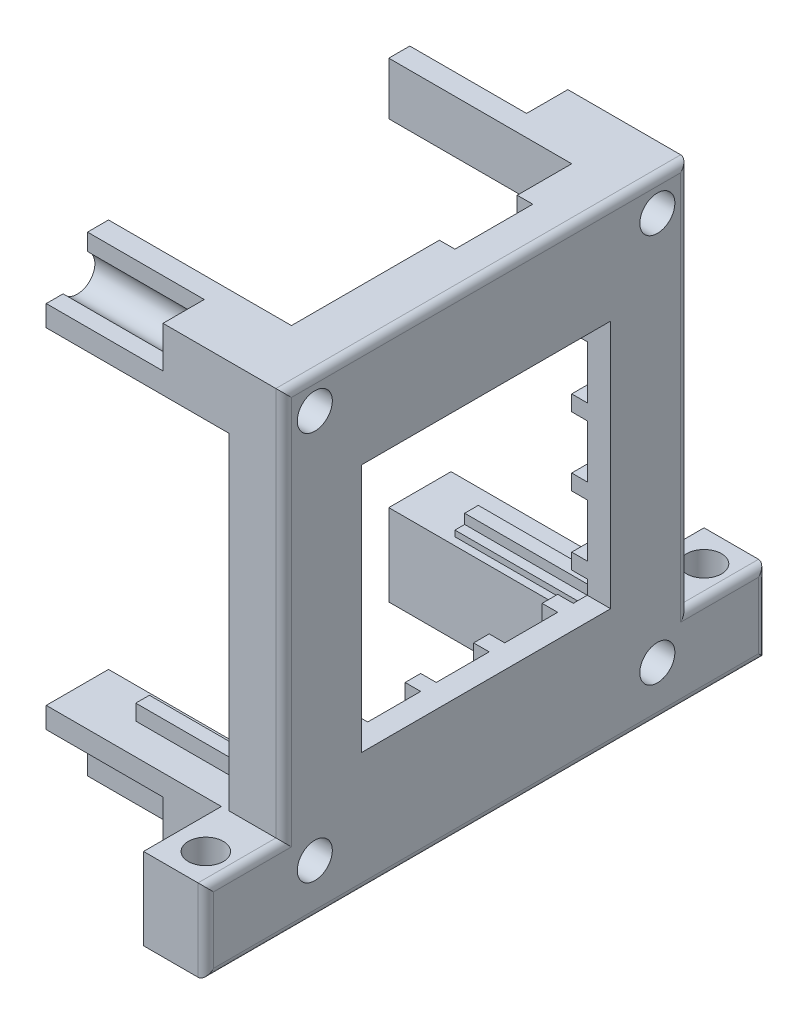
from build123d import *

# Parameters (mm, degrees)
SKETCH1_W               = 52
SKETCH1_H               = 58
SKETCH1_W_2             = 32
SKETCH1_H_2             = 32
BOSS_EXTRUDE1_DEPTH     = 3
SKETCH2_W               = 52
SKETCH2_H               = 58
SKETCH2_W_2             = 42
SKETCH2_H_2             = 42
BOSS_EXTRUDE2_DEPTH     = 4
SKETCH3_W               = 8
SKETCH3_H               = 8
BOSS_EXTRUDE3_DEPTH     = 23.5
SKETCH4_R               = 2.25
CUT_EXTRUDE1_DEPTH      = 50.469687689
SKETCH5_W               = 5.3
SKETCH5_H               = 5.3
CUT_EXTRUDE2_DEPTH      = 15
MIRROR2_COPY_1_SKETCH_W = 8
MIRROR2_COPY_1_SKETCH_H = 8
MIRROR2_COPY_1_DEPTH    = 23.5
MIRROR2_COPY_2_SKETCH_R = 2.25
MIRROR2_COPY_2_DEPTH    = 50.469687689
MIRROR2_COPY_3_SKETCH_W = 5.3
MIRROR2_COPY_3_SKETCH_H = 5.3
MIRROR2_COPY_3_DEPTH    = 15
SKETCH6_W               = 2
SKETCH6_H               = 0.75
SKETCH6_W_2             = 0.75
SKETCH6_H_2             = 2
BOSS_EXTRUDE4_DEPTH     = 4
SKETCH7_W               = 4.25
SKETCH7_H               = 2
SKETCH7_W_2             = 2
SKETCH7_H_2             = 4.25
BOSS_EXTRUDE5_DEPTH     = 2
CUT_EXTRUDE3_REACH      = 51.47
SKETCH8_W               = 42
SKETCH8_H               = 2
BOSS_EXTRUDE6_DEPTH     = 20
SKETCH10_W              = 8
SKETCH10_H              = 10
SKETCH10_R              = 2.25
BOSS_EXTRUDE7_DEPTH     = 8
SKETCH11_W              = 10
SKETCH11_H              = 8
CUT_EXTRUDE4_DEPTH      = 2
BOSS_EXTRUDE8_DEPTH     = 2.5
FILLET1_R               = 1


with BuildPart() as part:
    # Sketch1 → Boss-Extrude1 (new body)
    with BuildSketch(Plane(origin=(0, 0, 0), x_dir=(0, 0, -1), z_dir=(1, 0, 0))):
        Rectangle(SKETCH1_W, SKETCH1_H)
        Rectangle(SKETCH1_W_2, SKETCH1_H_2, mode=Mode.SUBTRACT)
    extrude(amount=-BOSS_EXTRUDE1_DEPTH)

    # Sketch2 → Boss-Extrude2 (add)
    with BuildSketch(Plane.ZY.offset(3)):
        Rectangle(SKETCH2_W, SKETCH2_H)
        Rectangle(SKETCH2_W_2, SKETCH2_H_2, mode=Mode.SUBTRACT)
    extrude(amount=BOSS_EXTRUDE2_DEPTH)

    # Sketch3 → Boss-Extrude3 (add)
    with BuildSketch(Plane.ZY.offset(7)):
        with Locations((-22, 25)):
            Rectangle(SKETCH3_W, SKETCH3_H)
    boss_extrude3 = extrude(amount=BOSS_EXTRUDE3_DEPTH)

    # Sketch4 → Cut-Extrude1 (cut, through all)
    with BuildSketch(Plane(origin=(0, 0, 0), x_dir=(0, 0, -1), z_dir=(1, 0, 0))):
        with Locations((22, 25)):
            Circle(SKETCH4_R)
    cut_extrude1 = extrude(amount=-CUT_EXTRUDE1_DEPTH, mode=Mode.SUBTRACT)

    # Sketch5 → Cut-Extrude2 (cut)
    with BuildSketch(Plane.ZY.offset(30.5)):
        with Locations((-23.35, 26.35)):
            Rectangle(SKETCH5_W, SKETCH5_H)
    cut_extrude2 = extrude(amount=-CUT_EXTRUDE2_DEPTH, mode=Mode.SUBTRACT)

    # Mirror1: Boss-Extrude3, Cut-Extrude1, Cut-Extrude2 across plane
    add(boss_extrude3.mirror(Plane.ZX))
    add(cut_extrude1.mirror(Plane.ZX), mode=Mode.SUBTRACT)
    add(cut_extrude2.mirror(Plane.ZX), mode=Mode.SUBTRACT)

    # Mirror2: Boss-Extrude3, Cut-Extrude1, Cut-Extrude2 across plane
    add(boss_extrude3.mirror(Plane.XY))
    add(cut_extrude1.mirror(Plane.XY), mode=Mode.SUBTRACT)
    add(cut_extrude2.mirror(Plane.XY), mode=Mode.SUBTRACT)

    # Mirror2 copy 1 sketch → Mirror2 copy 1 (add)
    with BuildSketch(Plane(origin=(-7, 0, 0), x_dir=(0, 0, -1), z_dir=(-1, 0, 0))):
        with Locations((-22, 25)):
            Rectangle(MIRROR2_COPY_1_SKETCH_W, MIRROR2_COPY_1_SKETCH_H)
    extrude(amount=MIRROR2_COPY_1_DEPTH)

    # Mirror2 copy 2 sketch → Mirror2 copy 2 (cut, through all)
    with BuildSketch(Plane(origin=(0, 0, 0), x_dir=(0, 0, 1), z_dir=(1, 0, 0))):
        with Locations((22, 25)):
            Circle(MIRROR2_COPY_2_SKETCH_R)
    extrude(amount=-MIRROR2_COPY_2_DEPTH, mode=Mode.SUBTRACT)

    # Mirror2 copy 3 sketch → Mirror2 copy 3 (cut)
    with BuildSketch(Plane(origin=(-30.5, 0, 0), x_dir=(0, 0, -1), z_dir=(-1, 0, 0))):
        with Locations((-23.35, 26.35)):
            Rectangle(MIRROR2_COPY_3_SKETCH_W, MIRROR2_COPY_3_SKETCH_H)
    extrude(amount=-MIRROR2_COPY_3_DEPTH, mode=Mode.SUBTRACT)

    # Sketch6 → Boss-Extrude4 (add)
    with BuildSketch(Plane.ZY.offset(3)):
        with Locations((-13.2, 20.625)):
            Rectangle(SKETCH6_W, SKETCH6_H)
        with Locations((-4.4, 20.625)):
            Rectangle(SKETCH6_W, SKETCH6_H)
        with Locations((4.4, 20.625)):
            Rectangle(SKETCH6_W, SKETCH6_H)
        with Locations((13.2, 20.625)):
            Rectangle(SKETCH6_W, SKETCH6_H)
        with Locations((20.625, 13.2)):
            Rectangle(SKETCH6_W_2, SKETCH6_H_2)
        with Locations((20.625, 4.4)):
            Rectangle(SKETCH6_W_2, SKETCH6_H_2)
        with Locations((-20.625, 13.2)):
            Rectangle(SKETCH6_W_2, SKETCH6_H_2)
        with Locations((-20.625, 4.4)):
            Rectangle(SKETCH6_W_2, SKETCH6_H_2)
    boss_extrude4 = extrude(amount=BOSS_EXTRUDE4_DEPTH)

    # Sketch7 → Boss-Extrude5 (add)
    with BuildSketch(Plane.ZY.offset(3)):
        with Locations((-18.125, 4.4)):
            Rectangle(SKETCH7_W, SKETCH7_H)
        with Locations((-18.125, 13.2)):
            Rectangle(SKETCH7_W, SKETCH7_H)
        with Locations((-13.2, 18.125)):
            Rectangle(SKETCH7_W_2, SKETCH7_H_2)
        with Locations((-4.4, 18.125)):
            Rectangle(SKETCH7_W_2, SKETCH7_H_2)
        with Locations((4.4, 18.125)):
            Rectangle(SKETCH7_W_2, SKETCH7_H_2)
        with Locations((13.2, 18.125)):
            Rectangle(SKETCH7_W_2, SKETCH7_H_2)
        with Locations((18.125, 13.2)):
            Rectangle(SKETCH7_W, SKETCH7_H)
        with Locations((18.125, 4.4)):
            Rectangle(SKETCH7_W, SKETCH7_H)
    boss_extrude5 = extrude(amount=BOSS_EXTRUDE5_DEPTH)

    # Mirror3: Boss-Extrude4, Boss-Extrude5 across plane
    add(boss_extrude4.mirror(Plane.ZX))
    add(boss_extrude5.mirror(Plane.ZX))

    # Cut-Extrude3: up to this face of the body (flat: up to its plane)
    cut_extrude3_end = Plane(part.part.faces().sort_by_distance((-5, 18.125, -13.2))[0])
    # Sketch8 → Cut-Extrude3 (cut, up to the picked face)
    with BuildSketch(Plane.ZY.offset(30.5), mode=Mode.PRIVATE) as cut_extrude3_sk1:
        with Locations((0, 21.25)):
            Rectangle(SKETCH8_W, SKETCH8_H)
    cut_extrude3_tool1 = split(extrude(cut_extrude3_sk1.sketch, amount=-CUT_EXTRUDE3_REACH, mode=Mode.PRIVATE), bisect_by=cut_extrude3_end, keep=Keep.BOTH, mode=Mode.PRIVATE)
    add(cut_extrude3_tool1.solids().sort_by(Axis((-30.5, 21.25, 0), (1, 0, 0)))[0], mode=Mode.SUBTRACT)

    # Sketch9 → Boss-Extrude6 (add)
    with BuildSketch(Plane.ZY.offset(3)):
        Polygon((-22, -21), (-22, -19), (-20.25, -19), (-20.25, -20.25), (-19, -20.25), (-19, -21), align=None)
    boss_extrude6 = extrude(amount=BOSS_EXTRUDE6_DEPTH)

    # Mirror4: Boss-Extrude6 across plane
    add(boss_extrude6.mirror(Plane.XY))

    # Sketch10 → Boss-Extrude7 (add)
    with BuildSketch(Plane.XZ.offset(29)):
        with Locations((-4, 31)):
            Rectangle(SKETCH10_W, SKETCH10_H)
        with Locations(Location((-4, 32, 0), (0, 0, 270))):
            Circle(SKETCH10_R, mode=Mode.SUBTRACT)
    boss_extrude7 = extrude(amount=-BOSS_EXTRUDE7_DEPTH)

    # Mirror5: Boss-Extrude7 across plane
    add(boss_extrude7.mirror(Plane.XY))

    # Sketch11 → Cut-Extrude4 (cut)
    with BuildSketch(Plane.ZY.offset(7)):
        with Locations((-6, 26.25)):
            Rectangle(SKETCH11_W, SKETCH11_H)
    extrude(amount=-CUT_EXTRUDE4_DEPTH, mode=Mode.SUBTRACT)

    # Sketch12 → Boss-Extrude8 (add)
    with BuildSketch(Plane.XZ.offset(29)):
        Polygon((-15.5, 20.7), (-30.5, 20.7), (-30.5, 18), (-7, 18), (-7, -18), (-30.5, -18), (-30.5, -20.7), (-15.5, -20.7), (-15.5, -26), (-8, -26), (-8, -36), (0, -36), (0, 36), (-8, 36), (-8, 26), (-15.5, 26), align=None)
    extrude(amount=BOSS_EXTRUDE8_DEPTH)

    # Fillet1
    fillet1_edges = [part.edges().sort_by_distance(p)[0] for p in [
        (0, 29, 0),
        (0, 4, 26),
        (0, -21, 31),
        (0, -26.25, 36),
        (0, 4, -26),
        (0, -26.25, -36),
        (0, -21, -31),
        (0, -31.5, 0),
    ]]
    fillet(fillet1_edges, radius=FILLET1_R)


solid = part.part
